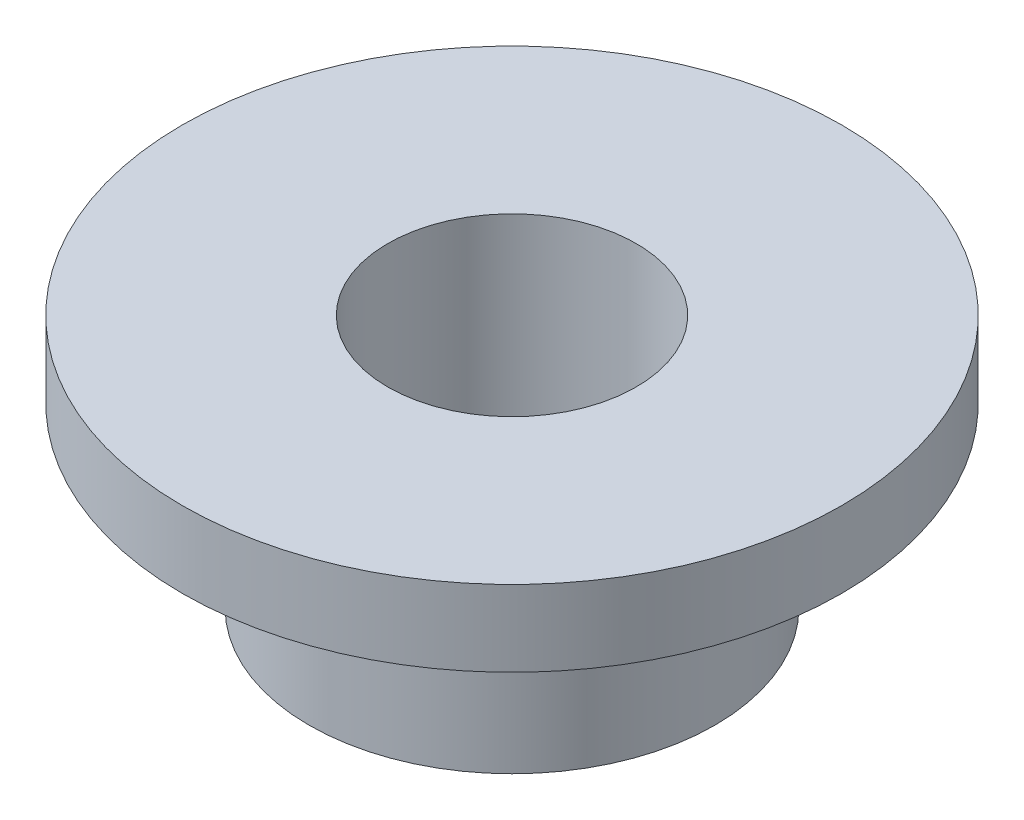
from build123d import *

# Parameters (mm, degrees)
SKETCH1_R           = 4
SKETCH1_R_2         = 2.45
BOSS_EXTRUDE1_DEPTH = 5
BOSS_EXTRUDE2_START = 3.5
SKETCH1_3_R         = 6.5
SKETCH1_3_R_2       = 4
BOSS_EXTRUDE2_DEPTH = 1.5


with BuildPart() as part:
    # Sketch1 → Boss-Extrude1 (new body)
    with BuildSketch(Plane(origin=(0, 0, 0), x_dir=(1, 0, 0), z_dir=(0, 1, 0))):
        Circle(SKETCH1_R)
        Circle(SKETCH1_R_2, mode=Mode.SUBTRACT)
    extrude(amount=BOSS_EXTRUDE1_DEPTH)

    # Sketch1<3> → Boss-Extrude2 (add)
    with BuildSketch(Plane(origin=(0, 0, 0), x_dir=(1, 0, 0), z_dir=(0, 1, 0)).offset(BOSS_EXTRUDE2_START)):
        Circle(SKETCH1_3_R)
        Circle(SKETCH1_3_R_2, mode=Mode.SUBTRACT)
    extrude(amount=BOSS_EXTRUDE2_DEPTH)


solid = part.part
